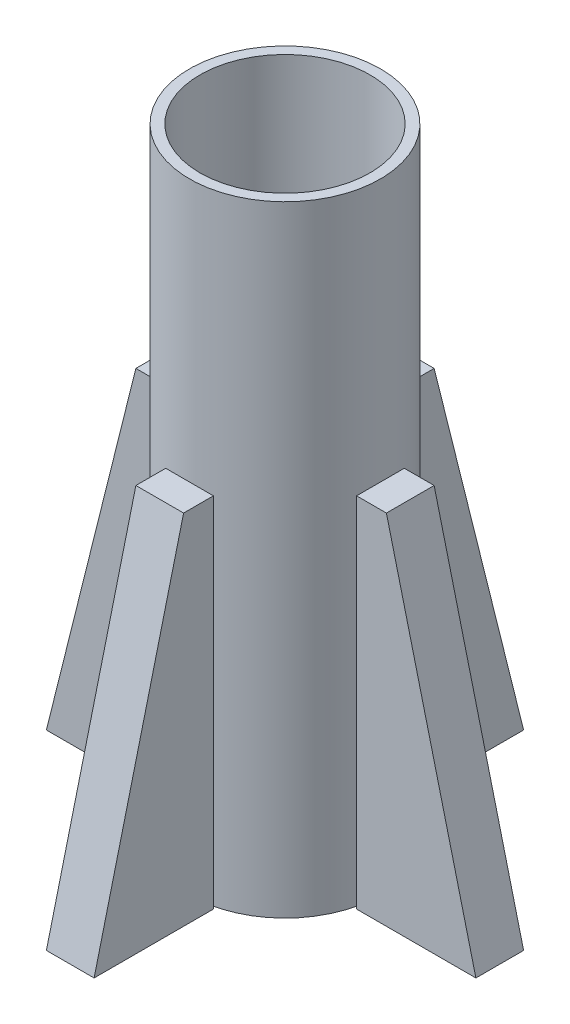
from build123d import *

# Parameters (mm, degrees)
SKETCH1_R                  = 8
BOSS_EXTRUDE1_DEPTH        = 52
SKETCH2_R                  = 7.125
CUT_EXTRUDE1_DEPTH         = 50
BOSS_EXTRUDE2_DEPTH        = 2
BOSS_EXTRUDE2_DEPTH_BACK   = 2
BOSS_EXTRUDE2_2_DEPTH      = 2
BOSS_EXTRUDE2_2_DEPTH_BACK = 2
BOSS_EXTRUDE3_DEPTH        = 2
BOSS_EXTRUDE3_DEPTH_BACK   = 2
BOSS_EXTRUDE3_2_DEPTH      = 2
BOSS_EXTRUDE3_2_DEPTH_BACK = 2


with BuildPart() as part:
    # Sketch1 → Boss-Extrude1 (new body)
    with BuildSketch(Plane(origin=(0, 0, 0), x_dir=(1, 0, 0), z_dir=(0, 1, 0))):
        Circle(SKETCH1_R)
    extrude(amount=BOSS_EXTRUDE1_DEPTH)

    # Sketch2 → Cut-Extrude1 (cut)
    with BuildSketch(Plane(origin=(0, 52, 0), x_dir=(1, 0, 0), z_dir=(0, 1, 0))):
        Circle(SKETCH2_R)
    extrude(amount=-CUT_EXTRUDE1_DEPTH, mode=Mode.SUBTRACT)


with BuildPart() as body_2:
    # Sketch3 → Boss-Extrude2 (new, two sides: drawn at the far end of the back side and taken through both)
    with BuildSketch(Plane(origin=(0, 0, 0), x_dir=(0, 0, -1), z_dir=(1, 0, 0)).offset(-BOSS_EXTRUDE2_DEPTH_BACK)):
        Polygon((-8, 30), (-10.5, 30), (-18, 0), (-8, 0), align=None)
    extrude(amount=BOSS_EXTRUDE2_DEPTH + BOSS_EXTRUDE2_DEPTH_BACK)


with BuildPart() as body_3:
    # Sketch3 → Boss-Extrude2 2 (new, two sides: drawn at the far end of the back side and taken through both)
    with BuildSketch(Plane(origin=(0, 0, 0), x_dir=(0, 0, -1), z_dir=(1, 0, 0)).offset(-BOSS_EXTRUDE2_2_DEPTH_BACK)):
        Polygon((8, 0), (18, 0), (10.5, 30), (8, 30), align=None)
    extrude(amount=BOSS_EXTRUDE2_2_DEPTH + BOSS_EXTRUDE2_2_DEPTH_BACK)


with BuildPart() as body_4:
    # Sketch4 → Boss-Extrude3 (new, two sides: drawn at the far end of the back side and taken through both)
    with BuildSketch(Plane.XY.offset(-BOSS_EXTRUDE3_DEPTH_BACK)):
        Polygon((8, 30), (10.5, 30), (18, 0), (8, 0), align=None)
    extrude(amount=BOSS_EXTRUDE3_DEPTH + BOSS_EXTRUDE3_DEPTH_BACK)


with BuildPart() as body_5:
    # Sketch4 → Boss-Extrude3 2 (new, two sides: drawn at the far end of the back side and taken through both)
    with BuildSketch(Plane.XY.offset(-BOSS_EXTRUDE3_2_DEPTH_BACK)):
        Polygon((-8, 30), (-8, 0), (-18, 0), (-10.5, 30), align=None)
    extrude(amount=BOSS_EXTRUDE3_2_DEPTH + BOSS_EXTRUDE3_2_DEPTH_BACK)


solid = Compound([part.part, body_2.part, body_3.part, body_4.part, body_5.part])
